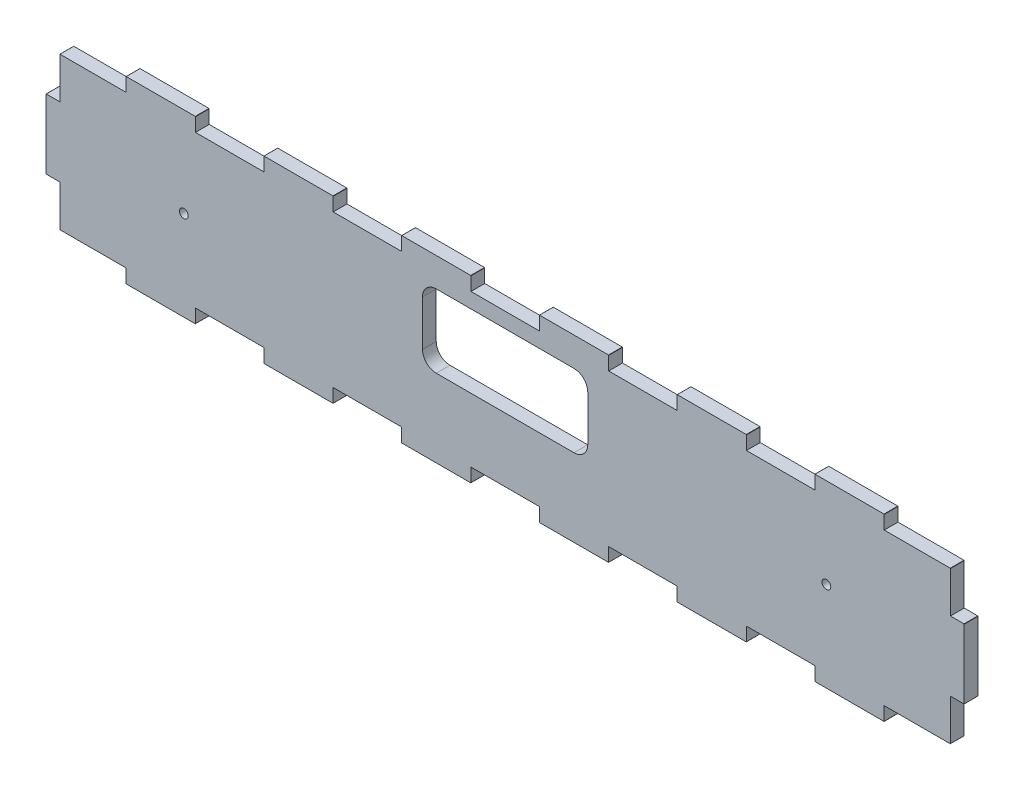
from build123d import *

# Parameters (mm, degrees)
BOSS_EXTRUDE1_DEPTH = 5
SKETCH1_R           = 1.6
CUT_EXTRUDE1_DEPTH  = 170.872450974
CUT_EXTRUDE2_DEPTH  = 170.872450974


with BuildPart() as part:
    # Model → Boss-Extrude1 (new body)
    with BuildSketch(Plane.XY):
        Polygon((-112.44, -32.58), (-112.43, -32.57), (-112.42, -32.55), (-112.41, -32.54), (-112.4, -32.52), (-112.4, -27.6), (-87.6, -27.6), (-87.6, -32.52), (-87.58, -32.56), (-87.57, -32.57), (-87.55, -32.58), (-87.54, -32.59), (-87.52, -32.6), (-62.48, -32.6), (-62.44, -32.58), (-62.43, -32.57), (-62.42, -32.55), (-62.41, -32.54), (-62.4, -32.52), (-62.4, -27.6), (-37.6, -27.6), (-37.6, -32.52), (-37.58, -32.56), (-37.57, -32.57), (-37.55, -32.58), (-37.54, -32.59), (-37.52, -32.6), (-12.48, -32.6), (-12.44, -32.58), (-12.43, -32.57), (-12.42, -32.55), (-12.41, -32.54), (-12.4, -32.52), (-12.4, -27.6), (12.4, -27.6), (12.4, -32.52), (12.42, -32.56), (12.43, -32.57), (12.45, -32.58), (12.46, -32.59), (12.48, -32.6), (37.52, -32.6), (37.56, -32.58), (37.57, -32.57), (37.58, -32.55), (37.59, -32.54), (37.6, -32.52), (37.6, -27.6), (62.4, -27.6), (62.4, -32.52), (62.42, -32.56), (62.43, -32.57), (62.45, -32.58), (62.46, -32.59), (62.48, -32.6), (87.52, -32.6), (87.56, -32.58), (87.57, -32.57), (87.58, -32.55), (87.59, -32.54), (87.6, -32.52), (87.6, -27.6), (112.4, -27.6), (112.4, -32.52), (112.42, -32.56), (112.43, -32.57), (112.45, -32.58), (112.46, -32.59), (112.48, -32.6), (137.52, -32.6), (137.56, -32.58), (137.57, -32.57), (137.58, -32.55), (137.59, -32.54), (137.6, -32.52), (137.6, -27.6), (161.56, -27.6), (161.6, -27.58), (161.61, -27.57), (161.62, -27.55), (161.63, -27.54), (161.64, -27.52), (161.64, -12.6), (166.56, -12.6), (166.6, -12.58), (166.61, -12.57), (166.62, -12.55), (166.63, -12.54), (166.64, -12.52), (166.64, 12.52), (166.62, 12.56), (166.61, 12.57), (166.59, 12.58), (166.58, 12.59), (166.56, 12.6), (161.64, 12.6), (161.64, 27.52), (161.62, 27.56), (161.61, 27.57), (161.59, 27.58), (161.58, 27.59), (161.56, 27.6), (137.6, 27.6), (137.6, 32.52), (137.58, 32.56), (137.57, 32.57), (137.55, 32.58), (137.54, 32.59), (137.52, 32.6), (112.48, 32.6), (112.44, 32.58), (112.43, 32.57), (112.42, 32.55), (112.41, 32.54), (112.4, 32.52), (112.4, 27.6), (87.6, 27.6), (87.6, 32.52), (87.58, 32.56), (87.57, 32.57), (87.55, 32.58), (87.54, 32.59), (87.52, 32.6), (62.48, 32.6), (62.44, 32.58), (62.43, 32.57), (62.42, 32.55), (62.41, 32.54), (62.4, 32.52), (62.4, 27.6), (37.6, 27.6), (37.6, 32.52), (37.58, 32.56), (37.57, 32.57), (37.55, 32.58), (37.54, 32.59), (37.52, 32.6), (12.48, 32.6), (12.44, 32.58), (12.43, 32.57), (12.42, 32.55), (12.41, 32.54), (12.4, 32.52), (12.4, 27.6), (-12.4, 27.6), (-12.4, 32.52), (-12.42, 32.56), (-12.43, 32.57), (-12.45, 32.58), (-12.46, 32.59), (-12.48, 32.6), (-37.52, 32.6), (-37.56, 32.58), (-37.57, 32.57), (-37.58, 32.55), (-37.59, 32.54), (-37.6, 32.52), (-37.6, 27.6), (-62.4, 27.6), (-62.4, 32.52), (-62.42, 32.56), (-62.43, 32.57), (-62.45, 32.58), (-62.46, 32.59), (-62.48, 32.6), (-87.52, 32.6), (-87.56, 32.58), (-87.57, 32.57), (-87.58, 32.55), (-87.59, 32.54), (-87.6, 32.52), (-87.6, 27.6), (-112.4, 27.6), (-112.4, 32.52), (-112.42, 32.56), (-112.43, 32.57), (-112.45, 32.58), (-112.46, 32.59), (-112.48, 32.6), (-137.52, 32.6), (-137.56, 32.58), (-137.57, 32.57), (-137.58, 32.55), (-137.59, 32.54), (-137.6, 32.52), (-137.6, 27.6), (-161.56, 27.6), (-161.6, 27.58), (-161.61, 27.57), (-161.62, 27.55), (-161.63, 27.54), (-161.64, 27.52), (-161.64, 12.6), (-166.56, 12.6), (-166.6, 12.58), (-166.61, 12.57), (-166.62, 12.55), (-166.63, 12.54), (-166.64, 12.52), (-166.64, -12.52), (-166.62, -12.56), (-166.61, -12.57), (-166.59, -12.58), (-166.58, -12.59), (-166.56, -12.6), (-161.64, -12.6), (-161.64, -27.52), (-161.62, -27.56), (-161.61, -27.57), (-161.59, -27.58), (-161.58, -27.59), (-161.56, -27.6), (-137.6, -27.6), (-137.6, -32.52), (-137.58, -32.56), (-137.57, -32.57), (-137.55, -32.58), (-137.54, -32.59), (-137.52, -32.6), (-112.48, -32.6), align=None)
    extrude(amount=BOSS_EXTRUDE1_DEPTH)

    # Sketch1 → Cut-Extrude1 (cut, through all)
    with BuildSketch(Plane.XY.offset(5)):
        with Locations((-116.605, 0)):
            Circle(SKETCH1_R)
        with Locations(Location((116.605, 0, 0), (0, 0, 180))):
            Circle(SKETCH1_R)
    extrude(amount=-CUT_EXTRUDE1_DEPTH, mode=Mode.SUBTRACT)

    # Sketch2 → Cut-Extrude2 (cut, through all)
    with BuildSketch(Plane.XY.offset(5)):
        with BuildLine():
            Line((-25, 22.1), (25, 22.1))
            ThreePointArc((25, 22.1), (28.535533906, 20.635533906), (30, 17.1))
            Line((30, 17.1), (30, 0.6))
            ThreePointArc((30, 0.6), (28.535533906, -2.935533906), (25, -4.4))
            Line((25, -4.4), (-25, -4.4))
            ThreePointArc((-25, -4.4), (-28.535533906, -2.935533906), (-30, 0.6))
            Line((-30, 0.6), (-30, 17.1))
            ThreePointArc((-30, 17.1), (-28.535533906, 20.635533906), (-25, 22.1))
        make_face()
    extrude(amount=-CUT_EXTRUDE2_DEPTH, mode=Mode.SUBTRACT)


solid = part.part
